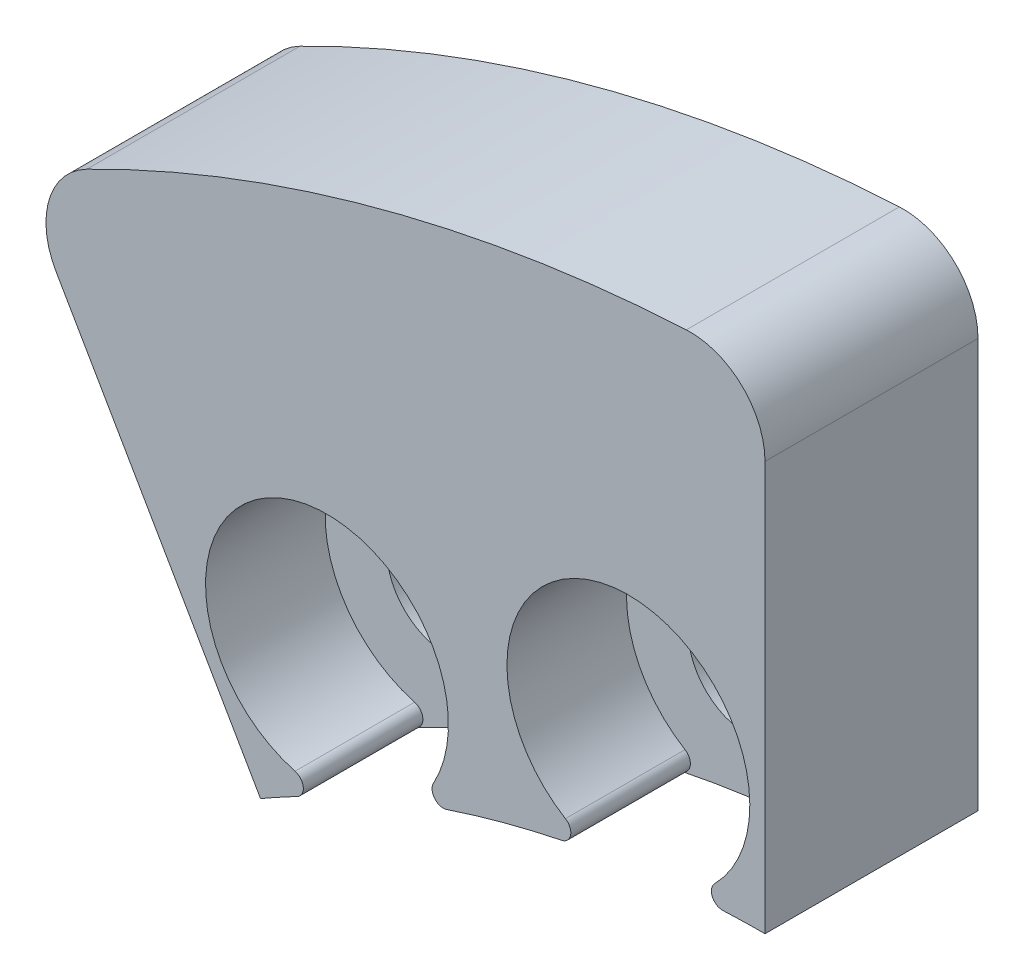
from build123d import *

# Parameters (mm, degrees)
EXTRUDE_2_DEPTH     = 6
SKETCH_2_R          = 4
EXTRUDE_3_DEPTH     = 6
EXTRUDE_4_DEPTH     = 6
SKETCH_5_R          = 27
CUT_EXTRUDE_2_DEPTH = 46.122056691
SKETCH_6_R          = 1.6
CUT_EXTRUDE_3_DEPTH = 46.122056691
FILLET_1_R          = 2
SKETCH_7_R          = 3.25
CUT_EXTRUDE_5_DEPTH = 3.5
FILLET_4_R          = 0.3
CUT_EXTRUDE_6_DEPTH = 6
CUT_EXTRUDE_7_DEPTH = 0.3


with BuildPart() as part:
    # 草图1 → 凸台-拉伸2 (new body)
    with BuildSketch(Plane.XY):
        with BuildLine():
            Line((-15, 25.980762114), (0, 0))
            Line((0, 0), (0, 30))
            ThreePointArc((0, 30), (-7.764571353, 28.977774789), (-15, 25.980762114))
        make_face()
    extrude(amount=EXTRUDE_2_DEPTH)

    # 草图2 → 凸台-拉伸3 (add)
    with BuildSketch(Plane.XY.offset(6)):
        with Locations((-3.656080302, 29.776384549)):
            Circle(SKETCH_2_R)
        with Locations((-11.721933855, 27.615145604)):
            Circle(SKETCH_2_R)
    extrude(amount=-EXTRUDE_3_DEPTH)

    # 草图4 → 凸台-拉伸4 (add, through all)
    with BuildSketch(Plane.XY.offset(6)):
        with BuildLine():
            Line((0, 0), (0, 40))
            ThreePointArc((0, 40), (-10.352761804, 38.637033052), (-20, 34.641016151))
            Line((-20, 34.641016151), (0, 0))
        make_face()
    extrude(amount=-EXTRUDE_4_DEPTH)

    # 草图5 → 切除-拉伸2 (cut, through all)
    with BuildSketch(Plane.XY.offset(6)):
        Circle(SKETCH_5_R)
    extrude(amount=-CUT_EXTRUDE_2_DEPTH, mode=Mode.SUBTRACT)

    # 草图6 → 切除-拉伸3 (cut, through all)
    with BuildSketch(Plane.XY.offset(6)):
        with Locations((-3.656080302, 29.776384549)):
            Circle(SKETCH_6_R)
        with Locations((-11.721933855, 27.615145604)):
            Circle(SKETCH_6_R)
    extrude(amount=-CUT_EXTRUDE_3_DEPTH, mode=Mode.SUBTRACT)

    # 圆角1
    fillet_1_edges = [part.edges().sort_by_distance(p)[0] for p in [
        (0, 40, 3),
        (-20, 34.641016151, 3),
    ]]
    fillet(fillet_1_edges, radius=FILLET_1_R)

    # 草图7 → 切除-拉伸5 (cut)
    with BuildSketch(Plane.XY.offset(6)):
        with Locations((-11.721933855, 27.615145604)):
            Circle(SKETCH_7_R)
        with Locations((-3.656080302, 29.776384549)):
            Circle(SKETCH_7_R)
    extrude(amount=-CUT_EXTRUDE_5_DEPTH, mode=Mode.SUBTRACT)

    # 圆角4
    fillet_4_edges = [part.edges().sort_by_distance(p)[0] for p in [
        (-2.110567489, 26.91738295, 4.25),
        (-4.464029693, 26.628414127, 4.25),
        (-9.448243946, 25.292897943, 4.25),
        (-11.630886413, 24.366421183, 4.25),
    ]]
    fillet(fillet_4_edges, radius=FILLET_4_R)

    # 草图8 → 切除-拉伸6 (cut)
    with BuildSketch(Plane.XY.offset(6)):
        with BuildLine():
            Line((-15.699530186, 27.192383937), (-14.076854363, 24.381826968))
            ThreePointArc((-14.076854363, 24.381826968), (-15.18603547, 25.615145604), (-15.699530186, 27.192383937))
        make_face()
        with BuildLine():
            Line((0, 31.399060372), (0, 28.153708727))
            ThreePointArc((0, 28.153708727), (0.343919698, 29.776384549), (0, 31.399060372))
        make_face()
    extrude(amount=-CUT_EXTRUDE_6_DEPTH, mode=Mode.SUBTRACT)

    # 草图9 → 切除-拉伸7 (cut)
    with BuildSketch(Plane.XY.offset(6)):
        with BuildLine():
            Line((0, 27), (0, 37.947331922))
            ThreePointArc((0, 37.947331922), (-0.623505597, 39.398284422), (-2.105263158, 39.944559918))
            ThreePointArc((-2.105263158, 39.944559918), (-10.352761804, 38.637033052), (-18.149068583, 35.645635211))
            ThreePointArc((-18.149068583, 35.645635211), (-19.159170525, 34.431667974), (-18.973665961, 32.86335345))
            Line((-18.973665961, 32.86335345), (-13.5, 23.382685902))
            ThreePointArc((-13.5, 23.382685902), (-13.010612738, 23.658485924), (-12.515593512, 23.924044788))
            ThreePointArc((-12.515593512, 23.924044788), (-12.356405623, 24.222223556), (-12.575834101, 24.479327629))
            ThreePointArc((-12.575834101, 24.479327629), (-12.991810022, 30.606786377), (-8.873046225, 26.051067832))
            ThreePointArc((-8.873046225, 26.051067832), (-8.840528862, 25.714624698), (-8.515455807, 25.622002506))
            ThreePointArc((-8.515455807, 25.622002506), (-6.988114218, 26.07999731), (-5.436400199, 26.447032969))
            ThreePointArc((-5.436400199, 26.447032969), (-5.201189771, 26.689782668), (-5.341250476, 26.997409651))
            ThreePointArc((-5.341250476, 26.997409651), (-4.052155668, 33.002159542), (-1.348672009, 27.487636645))
            ThreePointArc((-1.348672009, 27.487636645), (-1.410150609, 27.155263747), (-1.123200469, 26.976627304))
            ThreePointArc((-1.123200469, 26.976627304), (-0.561721812, 26.994156194), (0, 27))
        make_face()
    extrude(amount=-CUT_EXTRUDE_7_DEPTH, mode=Mode.SUBTRACT)


solid = part.part
